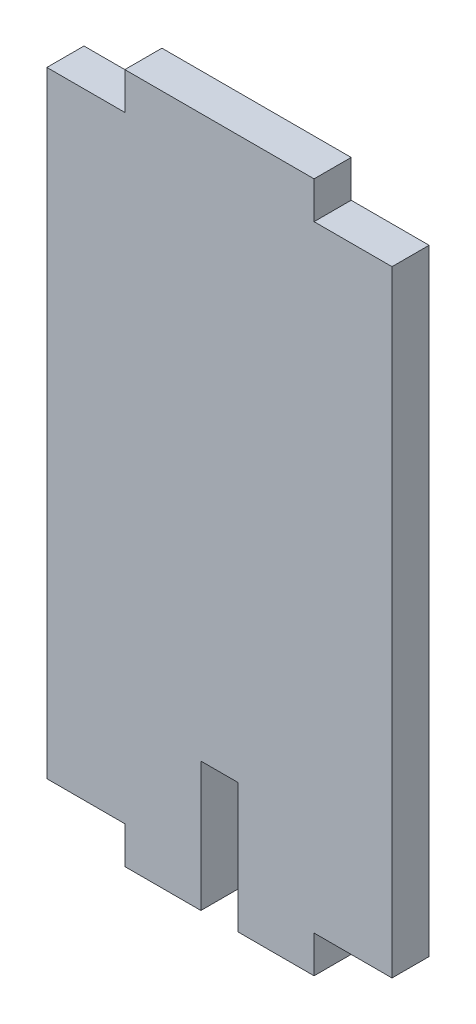
from build123d import *

# Parameters (mm, degrees)
SKETCH1_W           = 50.8
SKETCH1_H           = 101.6
BOSS_EXTRUDE1_DEPTH = 5.461
SKETCH2_W           = 5.461
SKETCH2_H           = 19.05
SKETCH2_W_2         = 11.472333333
SKETCH2_H_2         = 5.461
CUT_EXTRUDE1_DEPTH  = 5.461


with BuildPart() as part:
    # Sketch1 → Boss-Extrude1 (new body)
    with BuildSketch(Plane.XY):
        with Locations((25.4, 50.8)):
            Rectangle(SKETCH1_W, SKETCH1_H)
    extrude(amount=BOSS_EXTRUDE1_DEPTH)

    # Sketch2 → Cut-Extrude1 (cut)
    with BuildSketch(Plane.XY.offset(5.461)):
        with Locations((25.4, 9.525)):
            Rectangle(SKETCH2_W, SKETCH2_H)
        with Locations((5.736166666, 98.8695)):
            Rectangle(SKETCH2_W_2, SKETCH2_H_2)
        with Locations((45.063833333, 98.8695)):
            Rectangle(SKETCH2_W_2, SKETCH2_H_2)
        with Locations((45.063833333, 2.7305)):
            Rectangle(SKETCH2_W_2, SKETCH2_H_2)
        with Locations((5.736166666, 2.7305)):
            Rectangle(SKETCH2_W_2, SKETCH2_H_2)
    extrude(amount=-CUT_EXTRUDE1_DEPTH, mode=Mode.SUBTRACT)


solid = part.part
